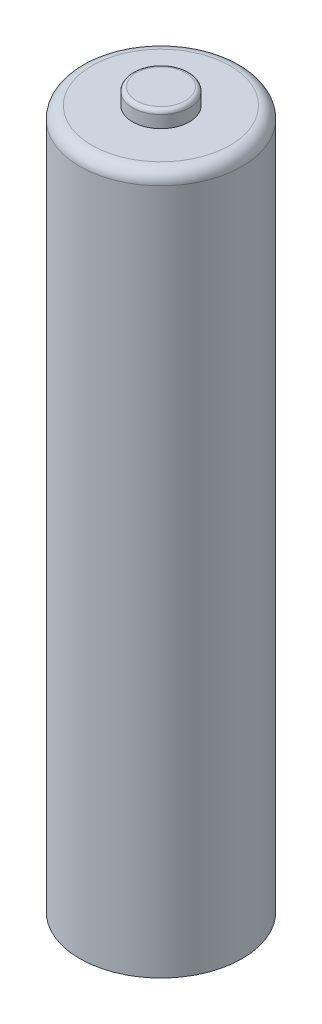
from build123d import *

# Parameters (mm, degrees)
SKETCH1_W = 5
SKETCH1_H = 43
SKETCH2_W = 1.75
SKETCH2_H = 1
FILLET1_R = 0.75
FILLET2_R = 0.25


with BuildPart() as part:
    # Sketch1 → Revolve1 (revolve)
    with BuildSketch(Plane.XY, mode=Mode.PRIVATE) as revolve1_sk:
        with Locations((-2.5, -21.5)):
            Rectangle(SKETCH1_W, SKETCH1_H)
    revolve(revolve1_sk.sketch.rotate(Axis((0, 0, 0), (0, -1, 0)), 270), axis=Axis((0, 0, 0), (0, -1, 0)))

    # Sketch2 → Revolve2 (revolve)
    with BuildSketch(Plane.XY, mode=Mode.PRIVATE) as revolve2_sk:
        with Locations((-0.875, 0.5)):
            Rectangle(SKETCH2_W, SKETCH2_H)
    revolve(revolve2_sk.sketch.rotate(Axis((0, 0, 0), (0, 1, 0)), 270), axis=Axis((0, 0, 0), (0, 1, 0)))

    # Fillet1
    fillet1_edges = [part.edges().sort_by_distance(p)[0] for p in [
        (0, 0, -5),
    ]]
    fillet(fillet1_edges, radius=FILLET1_R)

    # Fillet2
    fillet2_edges = [part.edges().sort_by_distance(p)[0] for p in [
        (0, 1, 1.75),
    ]]
    fillet(fillet2_edges, radius=FILLET2_R)


solid = part.part
